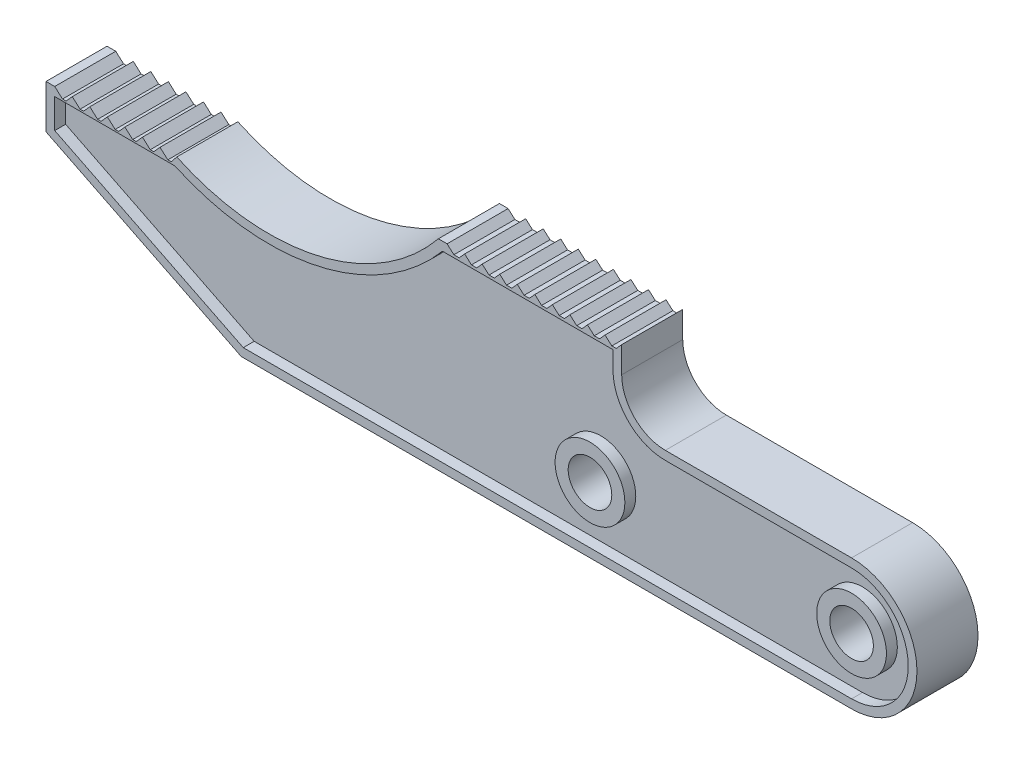
from build123d import *

# Parameters (mm, degrees)
SKETCH1_R           = 2.5
BOSS_EXTRUDE1_DEPTH = 3.5
CUT_EXTRUDE1_DEPTH  = 1.25
SKETCH3_R           = 4
SKETCH3_R_2         = 2.5
BOSS_EXTRUDE4_DEPTH = 1.25
CUT_EXTRUDE2_DEPTH  = 58.671073524
CUT_EXTRUDE3_DEPTH  = 58.671073524


with BuildPart() as part:
    # Sketch1 → Boss-Extrude1 (new, symmetric)
    with BuildSketch(Plane.XY):
        with BuildLine():
            Line((39.9669967, 0), (-30.0330033, 0))
            Line((-30.0330033, 0), (-52.420918739, 11.12570188))
            Line((-52.420918739, 11.12570188), (-52.420918739, 16.12570188))
            Line((-52.420918739, 16.12570188), (-37.420918739, 16.12570188))
            ThreePointArc((-37.420918739, 16.12570188), (-21.237684162, 14.399118341), (-7.420918739, 23))
            Line((-7.420918739, 23), (13.603539052, 23))
            Line((13.603539052, 23), (13.603539052, 20))
            ThreePointArc((13.603539052, 20), (15.068005146, 16.464466094), (18.603539052, 15))
            Line((18.603539052, 15), (39.9669967, 15))
            ThreePointArc((39.9669967, 15), (47.4669967, 7.5), (39.9669967, 0))
        make_face()
        with Locations((39.9669967, 7.5)):
            Circle(SKETCH1_R, mode=Mode.SUBTRACT)
        with Locations((9.9669967, 7.5)):
            Circle(SKETCH1_R, mode=Mode.SUBTRACT)
    extrude(amount=BOSS_EXTRUDE1_DEPTH, both=True)

    # Sketch2 → Cut-Extrude1 (cut)
    with BuildSketch(Plane.XY.offset(3.5)):
        with BuildLine():
            Line((39.9669967, 14), (18.603539052, 14))
            ThreePointArc((18.603539052, 14), (14.360898365, 15.757359313), (12.603539052, 20))
            Line((12.603539052, 20), (12.603539052, 22))
            Line((12.603539052, 22), (-6.950732305, 22))
            ThreePointArc((-6.950732305, 22), (-21.138653729, 13.396213633), (-37.641111866, 15.12570188))
            Line((-37.641111866, 15.12570188), (-51.420918739, 15.12570188))
            Line((-51.420918739, 15.12570188), (-51.420918739, 11.745424522))
            Line((-51.420918739, 11.745424522), (-29.798223995, 1))
            Line((-29.798223995, 1), (39.9669967, 1))
            ThreePointArc((39.9669967, 1), (46.4669967, 7.5), (39.9669967, 14))
        make_face()
    cut_extrude1 = extrude(amount=-CUT_EXTRUDE1_DEPTH, mode=Mode.SUBTRACT)

    # Sketch3 → Boss-Extrude4 (add)
    # profile 1 of 2: a face of its own
    with BuildSketch(Plane.XY.offset(2.25)):
        with Locations((9.9669967, 7.5)):
            Circle(SKETCH3_R)
        with Locations((9.9669967, 7.5)):
            Circle(SKETCH3_R_2, mode=Mode.SUBTRACT)
    # profile 2 of 2: a face of its own
    with BuildSketch(Plane.XY.offset(2.25)):
        with Locations((39.9669967, 7.5)):
            Circle(SKETCH3_R)
        with Locations((39.9669967, 7.5)):
            Circle(SKETCH3_R_2, mode=Mode.SUBTRACT)
    boss_extrude4 = extrude(amount=BOSS_EXTRUDE4_DEPTH)

    # Mirror1: Cut-Extrude1, Boss-Extrude4 across plane
    add(cut_extrude1.mirror(Plane.XY), mode=Mode.SUBTRACT)
    add(boss_extrude4.mirror(Plane.XY))

    # Sketch4 → Cut-Extrude2 (cut, through all)
    with BuildSketch(Plane.XY.offset(3.5)):
        Polygon((-43.37107402, 16.12570188), (-45.3835352, 16.12570188), (-44.489108009, 15.32570188), (-44.086615773, 15.32570188), align=None)
        Polygon((-41.35861284, 16.12570188), (-43.37107402, 16.12570188), (-42.476646829, 15.32570188), (-42.074154593, 15.32570188), align=None)
        Polygon((-39.34615166, 16.12570188), (-41.35861284, 16.12570188), (-40.464185649, 15.32570188), (-40.061693413, 15.32570188), align=None)
        Polygon((-37.420918739, 16.12570188), (-39.34615166, 16.12570188), (-38.451724469, 15.32570188), (-38.066677885, 15.32570188), align=None)
        Polygon((-45.3835352, 16.12570188), (-47.395996379, 16.12570188), (-46.501569188, 15.32570188), (-46.099076953, 15.32570188), align=None)
        Polygon((-47.395996379, 16.12570188), (-49.408457559, 16.12570188), (-48.514030368, 15.32570188), (-48.111538132, 15.32570188), align=None)
        Polygon((-49.408457559, 16.12570188), (-51.420918739, 16.12570188), (-50.526491548, 15.32570188), (-50.123999312, 15.32570188), align=None)
    extrude(amount=-CUT_EXTRUDE2_DEPTH, mode=Mode.SUBTRACT)

    # Sketch5 → Cut-Extrude3 (cut, through all)
    with BuildSketch(Plane.XY.offset(3.5)):
        Polygon((-4.408457559, 23), (-6.420918739, 23), (-5.642537797, 22.30379492), (-5.031162313, 22.30379492), align=None)
        Polygon((-2.395996379, 23), (-4.408457559, 23), (-3.630076617, 22.30379492), (-3.018701133, 22.30379492), align=None)
        Polygon((-0.3835352, 23), (-2.395996379, 23), (-1.617615437, 22.30379492), (-1.006239954, 22.30379492), align=None)
        Polygon((1.62892598, 23), (-0.3835352, 23), (0.394845743, 22.30379492), (1.006221226, 22.30379492), align=None)
        Polygon((3.64138716, 23), (1.62892598, 23), (2.407306922, 22.30379492), (3.018682406, 22.30379492), align=None)
        Polygon((5.65384834, 23), (3.64138716, 23), (4.419768102, 22.30379492), (5.031143586, 22.30379492), align=None)
        Polygon((7.666309519, 23), (5.65384834, 23), (6.432229282, 22.30379492), (7.043604765, 22.30379492), align=None)
        Polygon((9.678770699, 23), (7.666309519, 23), (8.444690462, 22.30379492), (9.056065945, 22.30379492), align=None)
        Polygon((11.691231879, 23), (9.678770699, 23), (10.457151641, 22.30379492), (11.068527125, 22.30379492), align=None)
        Polygon((13.603539052, 23), (11.691231879, 23), (12.469612821, 22.30379492), (12.984312686, 22.30379492), align=None)
    extrude(amount=-CUT_EXTRUDE3_DEPTH, mode=Mode.SUBTRACT)


solid = part.part
